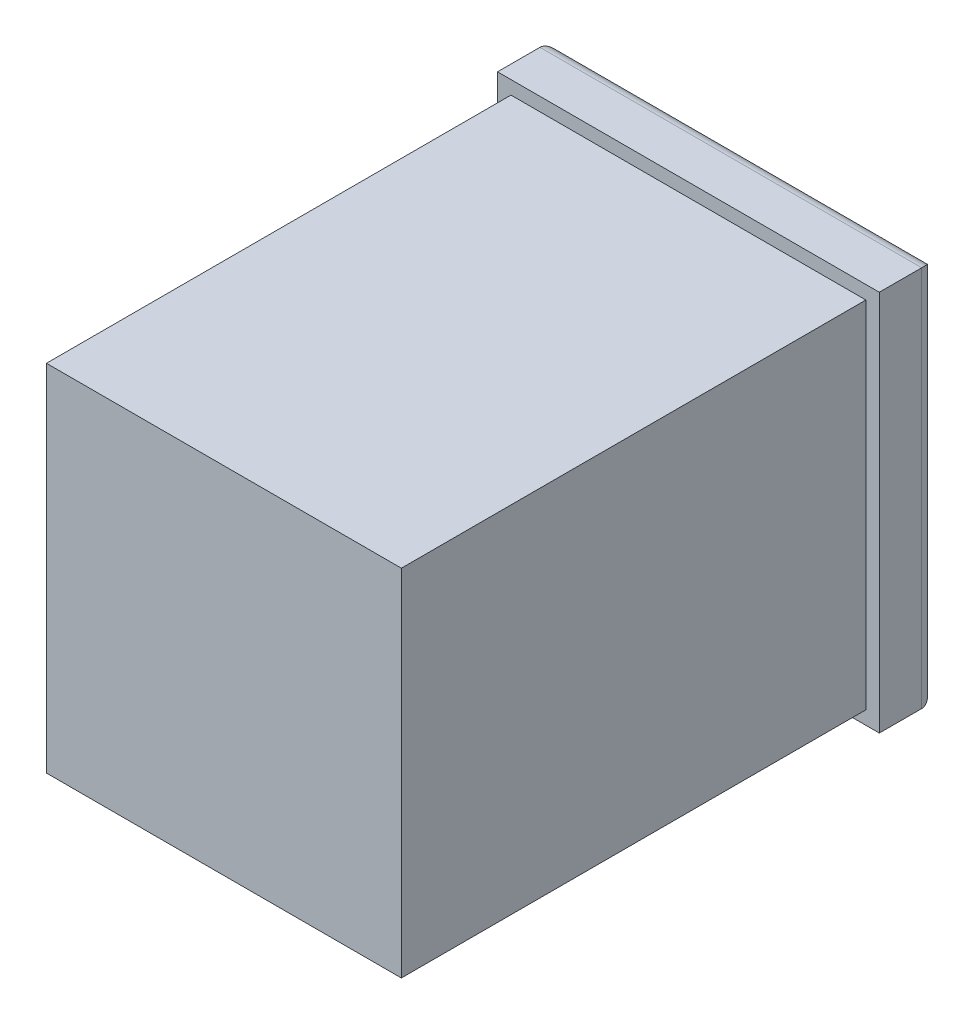
from build123d import *

# Parameters (mm, degrees)
SKETCH1_W           = 25.1
SKETCH1_H           = 25.1
BOSS_EXTRUDE1_DEPTH = 32.85
SKETCH2_W           = 27
SKETCH2_H           = 27
BOSS_EXTRUDE2_DEPTH = 4
FILLET1_R           = 1
SKETCH3_R           = 1.415831881
SKETCH3_W           = 1.309672559
SKETCH3_H           = 7.543446756
SKETCH3_W_2         = 1.023845508
SKETCH3_H_2         = 7.18639052
CUT_EXTRUDE1_DEPTH  = 24


with BuildPart() as part:
    # Sketch1 → Boss-Extrude1 (new body)
    with BuildSketch(Plane.XY):
        Rectangle(SKETCH1_W, SKETCH1_H)
    extrude(amount=BOSS_EXTRUDE1_DEPTH)

    # Sketch2 → Boss-Extrude2 (add)
    with BuildSketch(Plane(origin=(0, 0, 0), x_dir=(-1, 0, 0), z_dir=(0, 0, -1))):
        Rectangle(SKETCH2_W, SKETCH2_H)
    extrude(amount=BOSS_EXTRUDE2_DEPTH)

    # Fillet1
    fillet1_edges = [part.edges().sort_by_distance(p)[0] for p in [
        (-13.5, 0, -4),
        (0, 13.5, -4),
        (13.5, 0, -4),
        (0, -13.5, -4),
    ]]
    fillet(fillet1_edges, radius=FILLET1_R)

    # Sketch3 → Cut-Extrude1 (cut)
    with BuildSketch(Plane(origin=(0, 0, -4), x_dir=(-1, 0, 0), z_dir=(0, 0, -1))):
        with Locations((0, -5.370956585)):
            Circle(SKETCH3_R)
        with Locations((-6.845163721, 5.728276622)):
            Rectangle(SKETCH3_W, SKETCH3_H)
        with Locations((6.988077246, 5.90680474)):
            Rectangle(SKETCH3_W_2, SKETCH3_H_2)
    extrude(amount=-CUT_EXTRUDE1_DEPTH, mode=Mode.SUBTRACT)


solid = part.part
